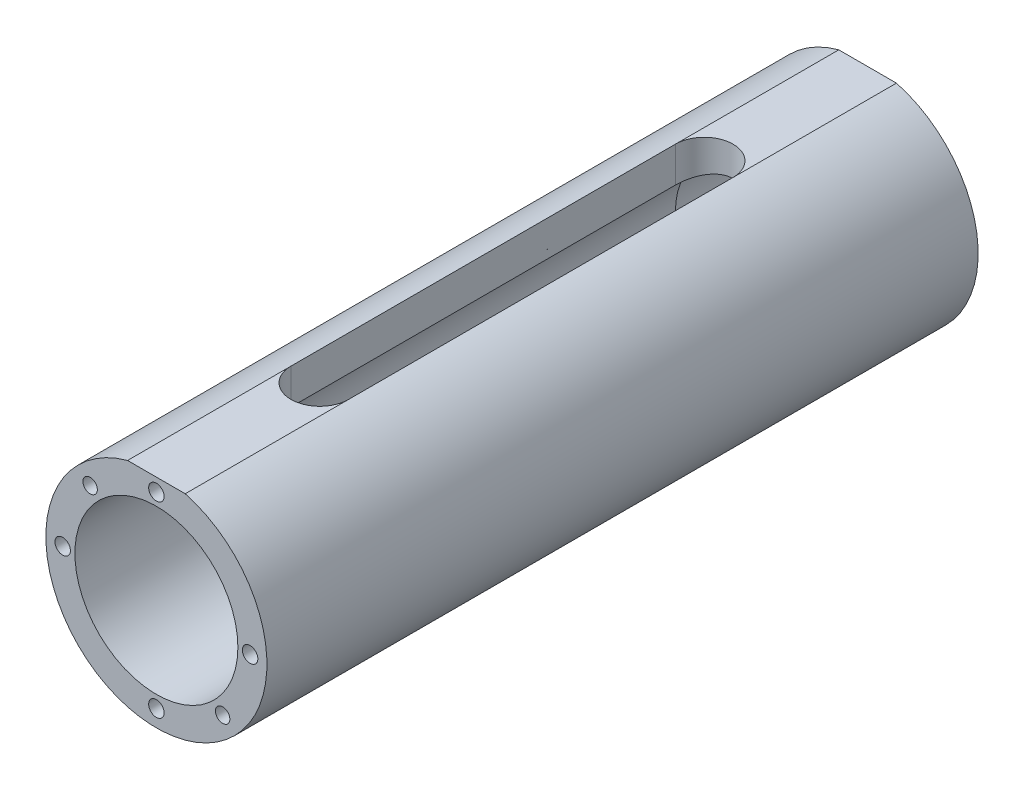
from build123d import *

# Parameters (mm, degrees)
BOLT_CIRCLE_R                      = 36.5125
BOLT_CIRCLE_R_2                    = 25.4
BASE_SHAPE_DEPTH                   = 117.475
BOLT_PATTERN_COUNT                 = 4
SLOT_DEPTH                         = 129.3226439
SKETCH17_R                         = 26.924
INNER_STEP_DEPTH                   = 38.1
EXTRUDE1_DEPTH                     = 129.322644049
EXTRUDE1_DEPTH_BACK                = 129.322644049
SKETCH20_W                         = 37.44274537
SKETCH20_H                         = 1.704436823
ALIGNMENT_PIN_HOLES_D              = 4.7625
ALIGNMENT_PIN_HOLES_DEPTH          = 12.7
ALIGNMENT_PIN_HOLES_TIP            = 1.430799349
F_3_16_0_1875_DIAMETER_HOLE1_D     = 4.7625
F_3_16_0_1875_DIAMETER_HOLE1_DEPTH = 12.7
F_3_16_0_1875_DIAMETER_HOLE1_TIP   = 1.430799349


with BuildPart() as part:
    # Bolt circle → Base shape (new, symmetric)
    with BuildSketch(Plane.XY):
        Circle(BOLT_CIRCLE_R)
        Circle(BOLT_CIRCLE_R_2, mode=Mode.SUBTRACT)
    extrude(amount=BASE_SHAPE_DEPTH, both=True)

    # Sketch10 → 1/4-20 #1 (revolve, cut)
    with BuildSketch(Plane(origin=(0, 30.95625, -117.475), x_dir=(0, 1, 0), z_dir=(1, 0, 0))):
        Polygon((0, 0), (0, 20.583816902), (2.5527, 19.05), (2.5527, 0.6223), (3.175, 0), align=None)
    hole_wizard_1_4_20_1 = revolve(axis=Axis((0, 30.95625, -123.825), (0, 0, 1)), mode=Mode.SUBTRACT)

    # Sketch11 → 1/4-20 #2 (revolve, cut)
    with BuildSketch(Plane(origin=(0, 30.95625, 117.475), x_dir=(0, -1, 0), z_dir=(1, 0, 0))):
        Polygon((0, 0), (0, 20.583816902), (2.5527, 19.05), (2.5527, 0), align=None)
    hole_wizard_1_4_20_2 = revolve(axis=Axis((0, 30.95625, 123.825), (0, 0, -1)), mode=Mode.SUBTRACT)

    # Bolt pattern: 1/4-20 #1, 1/4-20 #2 ×4 about axis
    bolt_pattern_axis = Axis((0, 0, -80.9), (0, 0, 1))
    add([hole_wizard_1_4_20_1.rotate(bolt_pattern_axis, i * 360 / BOLT_PATTERN_COUNT) for i in range(1, BOLT_PATTERN_COUNT)], mode=Mode.SUBTRACT)
    add([hole_wizard_1_4_20_2.rotate(bolt_pattern_axis, i * 360 / BOLT_PATTERN_COUNT) for i in range(1, BOLT_PATTERN_COUNT)], mode=Mode.SUBTRACT)

    # Sketch14 → Slot (cut, through all)
    with BuildSketch(Plane(origin=(0, 0, 0), x_dir=(1, 0, 0), z_dir=(0, 1, 0))):
        with BuildLine():
            Line((-9.525, 63.5), (-9.525, -63.5))
            ThreePointArc((-9.525, -63.5), (0, -73.025), (9.525, -63.5))
            Line((9.525, -63.5), (9.525, 63.5))
            ThreePointArc((9.525, 63.5), (0, 73.025), (-9.525, 63.5))
        make_face()
    extrude(amount=SLOT_DEPTH, mode=Mode.SUBTRACT)

    # Sketch17 → Inner Step (cut)
    with BuildSketch(Plane.XY.offset(117.475)):
        Circle(SKETCH17_R)
    inner_step = extrude(amount=-INNER_STEP_DEPTH, mode=Mode.SUBTRACT)

    # Step Mirror: Inner Step across plane
    add(inner_step.mirror(Plane.XY), mode=Mode.SUBTRACT)

    # Sketch20 → Extrude1 (cut, two sides: drawn at the far end of the back side and taken through both)
    with BuildSketch(Plane.XY.offset(-EXTRUDE1_DEPTH_BACK)):
        with Locations((-0.049008829, 36.100438668)):
            Rectangle(SKETCH20_W, SKETCH20_H)
    extrude(amount=EXTRUDE1_DEPTH + EXTRUDE1_DEPTH_BACK, mode=Mode.SUBTRACT)

    # Alignment_pin_holes
    with Locations(Plane.XY.offset(117.475)):
        with Locations((-21.889374295, 21.889374295), (21.889374295, -21.889374295)):
            Hole(ALIGNMENT_PIN_HOLES_D / 2, depth=ALIGNMENT_PIN_HOLES_DEPTH)
            with Locations((0, 0, -(ALIGNMENT_PIN_HOLES_DEPTH + ALIGNMENT_PIN_HOLES_TIP / 2))):  # 118° drill point
                Cone(0, ALIGNMENT_PIN_HOLES_D / 2, ALIGNMENT_PIN_HOLES_TIP, mode=Mode.SUBTRACT)

    # 3/16 (0.1875) Diameter Hole1
    with Locations(Plane(origin=(0, 0, -117.475), x_dir=(-1, 0, 0), z_dir=(0, 0, -1))):
        with Locations((-21.889374295, 21.889374295), (21.889374295, -21.889374295)):
            Hole(F_3_16_0_1875_DIAMETER_HOLE1_D / 2, depth=F_3_16_0_1875_DIAMETER_HOLE1_DEPTH)
            with Locations((0, 0, -(F_3_16_0_1875_DIAMETER_HOLE1_DEPTH + F_3_16_0_1875_DIAMETER_HOLE1_TIP / 2))):  # 118° drill point
                Cone(0, F_3_16_0_1875_DIAMETER_HOLE1_D / 2, F_3_16_0_1875_DIAMETER_HOLE1_TIP, mode=Mode.SUBTRACT)


solid = part.part
